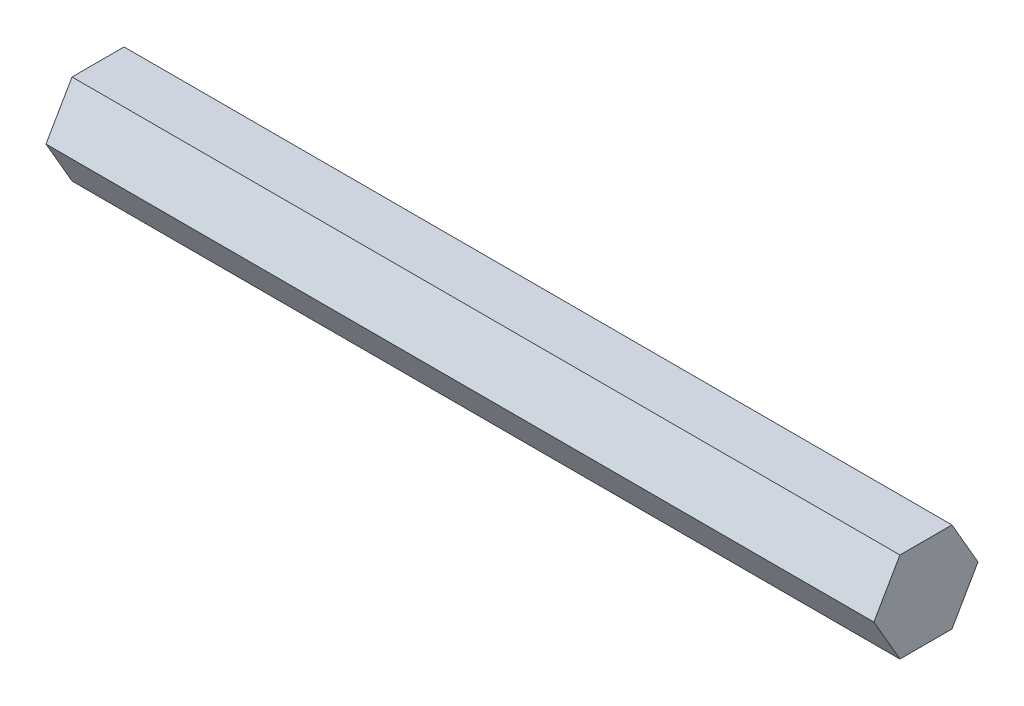
from build123d import *

# Parameters (mm, degrees)
BOSS_EXTRUDE1_DEPTH = 45


with BuildPart() as part:
    # Sketch1 → Boss-Extrude1 (new body)
    with BuildSketch(Plane(origin=(0, 0, 0), x_dir=(0, 0, -1), z_dir=(1, 0, 0))):
        Polygon((2.829016319, 0), (1.41450816, 2.45), (-1.41450816, 2.45), (-2.829016319, 0), (-1.41450816, -2.45), (1.41450816, -2.45), align=None)
    extrude(amount=BOSS_EXTRUDE1_DEPTH)


solid = part.part
